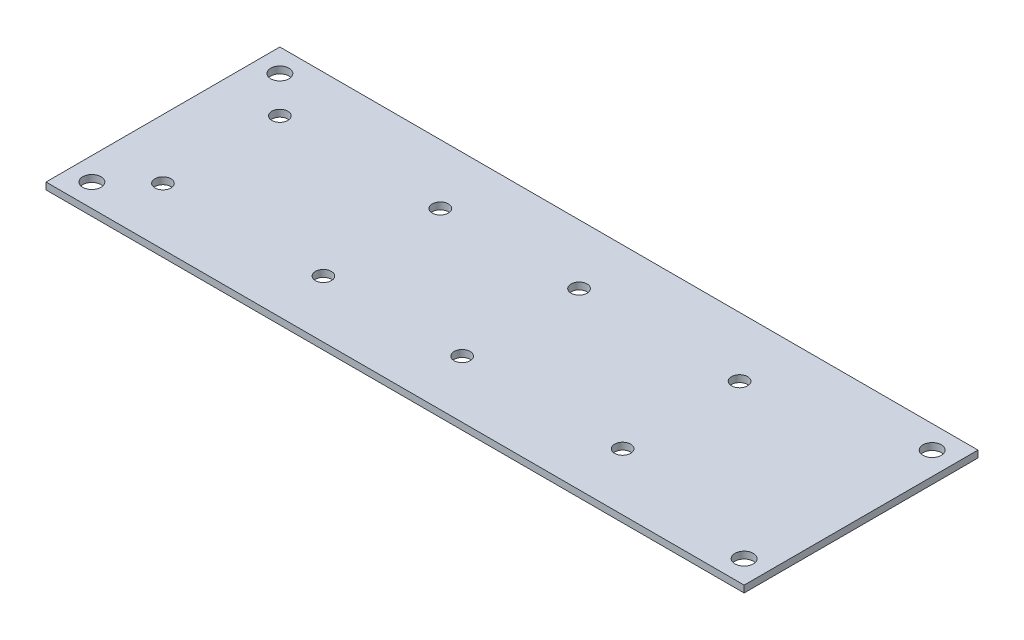
from build123d import *

# Parameters (mm, degrees)
SKETCH1_W           = 152.25
SKETCH1_H           = 51
SKETCH1_R           = 1.75
SKETCH1_R_2         = 2
BOSS_EXTRUDE1_DEPTH = 1.5


with BuildPart() as part:
    # Sketch1 → Boss-Extrude1 (new body)
    with BuildSketch(Plane(origin=(0, 0, 0), x_dir=(1, 0, 0), z_dir=(0, 1, 0))):
        Rectangle(SKETCH1_W, SKETCH1_H)
        with Locations(Location((-63.125, 12.5, 0), (0, 0, 270))):
            Circle(SKETCH1_R, mode=Mode.SUBTRACT)
        with Locations(Location((-63.125, -13, 0), (0, 0, 270))):
            Circle(SKETCH1_R, mode=Mode.SUBTRACT)
        with Locations(Location((-28.125, 12.5, 0), (0, 0, 270))):
            Circle(SKETCH1_R, mode=Mode.SUBTRACT)
        with Locations(Location((-28.125, -13, 0), (0, 0, 270))):
            Circle(SKETCH1_R, mode=Mode.SUBTRACT)
        with Locations(Location((2.125, 12.5, 0), (0, 0, 270))):
            Circle(SKETCH1_R, mode=Mode.SUBTRACT)
        with Locations(Location((37.125, 12.5, 0), (0, 0, 270))):
            Circle(SKETCH1_R, mode=Mode.SUBTRACT)
        with Locations(Location((37.125, -13, 0), (0, 0, 270))):
            Circle(SKETCH1_R, mode=Mode.SUBTRACT)
        with Locations(Location((2.125, -13, 0), (0, 0, 270))):
            Circle(SKETCH1_R, mode=Mode.SUBTRACT)
        with Locations(Location((-71.125, 20.5, 0), (0, 0, 270))):
            Circle(SKETCH1_R_2, mode=Mode.SUBTRACT)
        with Locations(Location((71.125, 20.5, 0), (0, 0, 270))):
            Circle(SKETCH1_R_2, mode=Mode.SUBTRACT)
        with Locations(Location((71.125, -20.5, 0), (0, 0, 270))):
            Circle(SKETCH1_R_2, mode=Mode.SUBTRACT)
        with Locations(Location((-71.125, -20.5, 0), (0, 0, 270))):
            Circle(SKETCH1_R_2, mode=Mode.SUBTRACT)
    extrude(amount=-BOSS_EXTRUDE1_DEPTH)


solid = part.part
